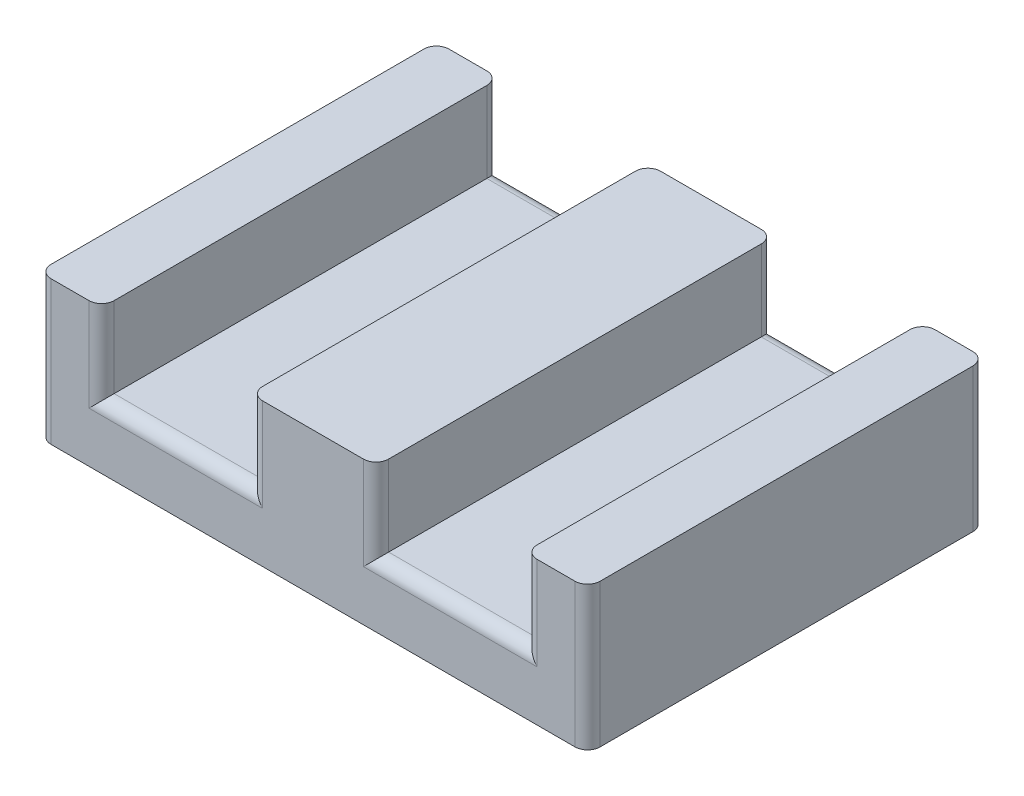
from build123d import *

# Parameters (mm, degrees)
EXTRUDE_1_DEPTH      = 7.9
EXTRUDE_1_DEPTH_BACK = 7.9
FILLET_1_R           = 0.5


with BuildPart() as part:
    # Эскиз1 → Бобышка-Вытянуть1 (new, two sides: drawn at the far end of the back side and taken through both)
    with BuildSketch(Plane.XY.offset(-EXTRUDE_1_DEPTH_BACK)):
        Polygon((-10.9, -2.911609978), (10.9, -2.911609978), (10.9, 2.788390022), (8.4, 2.788390022), (8.4, -0.411609978), (2.5, -0.411609978), (2.5, 2.788390022), (-2.5, 2.788390022), (-2.5, -0.411609978), (-8.4, -0.411609978), (-8.4, 2.788390022), (-10.9, 2.788390022), align=None)
    extrude(amount=EXTRUDE_1_DEPTH + EXTRUDE_1_DEPTH_BACK)

    # Скругление1
    fillet_1_edges = [part.edges().sort_by_distance(p)[0] for p in [
        (10.9, -0.061609978, 7.9),
        (8.4, 1.188390022, 7.9),
        (5.45, -0.411609978, 7.9),
        (2.5, 1.188390022, 7.9),
        (-2.5, 1.188390022, 7.9),
        (-5.45, -0.411609978, 7.9),
        (-8.4, 1.188390022, 7.9),
        (-10.9, -0.061609978, 7.9),
        (-10.9, -0.061609978, -7.9),
        (-8.4, 1.188390022, -7.9),
        (-5.45, -0.411609978, -7.9),
        (5.45, -0.411609978, -7.9),
        (-2.5, 1.188390022, -7.9),
        (2.5, 1.188390022, -7.9),
        (8.4, 1.188390022, -7.9),
        (10.9, -0.061609978, -7.9),
    ]]
    fillet(fillet_1_edges, radius=FILLET_1_R)


solid = part.part
